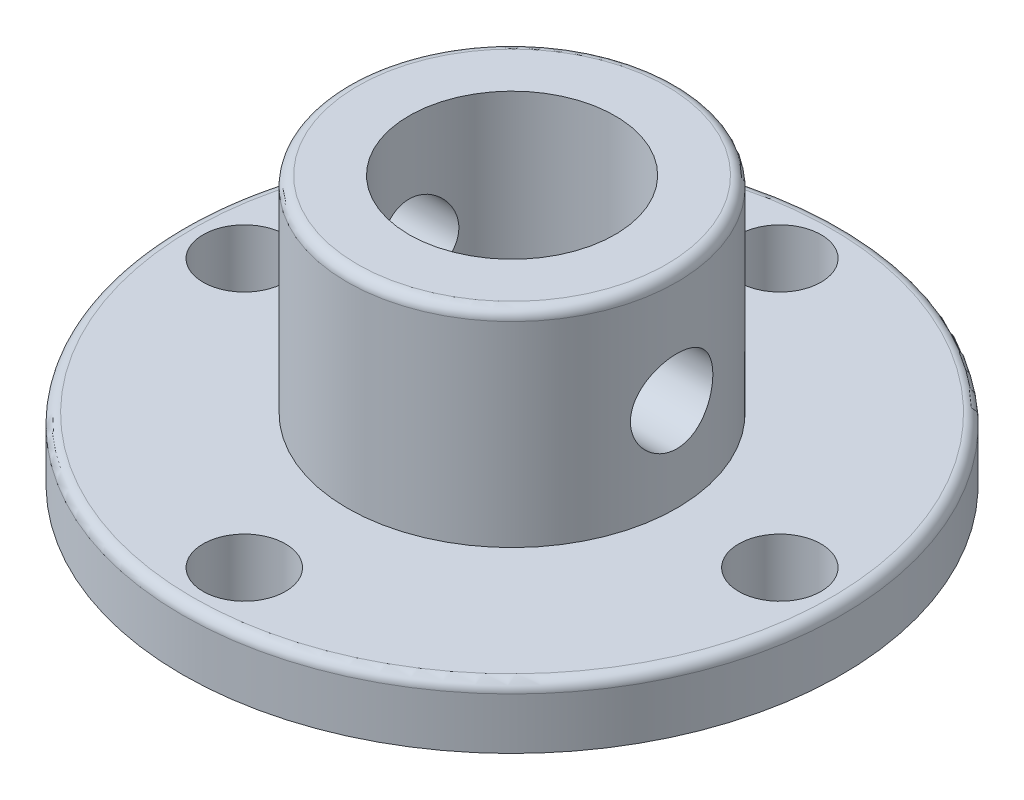
from build123d import *

# Parameters (mm, degrees)
SKETCH_1_R               = 16
EXTRUDE_1_DEPTH          = 3
SKETCH_2_R               = 8
EXTRUDE_2_DEPTH          = 10
SKETCH_3_R               = 5
CUT_EXTRUDE_1_DEPTH      = 27.095976701
SKETCH_4_R               = 2
CUT_EXTRUDE_2_DEPTH      = 7
CUT_EXTRUDE_3_DEPTH      = 27.095976701
CUT_EXTRUDE_3_DEPTH_BACK = 27.095976701
SKETCH_5_R               = 2
FILLET_1_R               = 0.5
FILLET_2_R               = 0.5


with BuildPart() as part:
    # 草图1 → 凸台-拉伸1 (new body)
    with BuildSketch(Plane(origin=(0, 0, 0), x_dir=(1, 0, 0), z_dir=(0, 1, 0))):
        with Locations(Location((0, 0, 0), (0, 0, 270))):
            Circle(SKETCH_1_R)
    extrude(amount=EXTRUDE_1_DEPTH)

    # 草图2 → 凸台-拉伸2 (add)
    with BuildSketch(Plane(origin=(0, 3, 0), x_dir=(1, 0, 0), z_dir=(0, 1, 0))):
        with Locations(Location((0, 0, 0), (0, 0, 270))):
            Circle(SKETCH_2_R)
    extrude(amount=EXTRUDE_2_DEPTH)

    # 草图3 → 切除-拉伸1 (cut, through all)
    with BuildSketch(Plane(origin=(0, 13, 0), x_dir=(1, 0, 0), z_dir=(0, 1, 0))):
        with Locations(Location((0, 0, 0), (0, 0, 270))):
            Circle(SKETCH_3_R)
    extrude(amount=-CUT_EXTRUDE_1_DEPTH, mode=Mode.SUBTRACT)

    # 草图4 → 切除-拉伸2 (cut)
    with BuildSketch(Plane(origin=(0, 3, 0), x_dir=(1, 0, 0), z_dir=(0, 1, 0))):
        with Locations(Location((0, 13, 0), (0, 0, 270))):
            Circle(SKETCH_4_R)
        with Locations(Location((-13, 0, 0), (0, 0, 270))):
            Circle(SKETCH_4_R)
        with Locations(Location((0, -13, 0), (0, 0, 270))):
            Circle(SKETCH_4_R)
        with Locations(Location((13, 0, 0), (0, 0, 270))):
            Circle(SKETCH_4_R)
    extrude(amount=-CUT_EXTRUDE_2_DEPTH, mode=Mode.SUBTRACT)

    # 草图5 → 切除-拉伸3 (cut, two sides: drawn at the far end of the back side and taken through both)
    with BuildSketch(Plane(origin=(0, 0, 0), x_dir=(0, 0, -1), z_dir=(1, 0, 0)).offset(-CUT_EXTRUDE_3_DEPTH_BACK)):
        with Locations((0, 7.5)):
            Circle(SKETCH_5_R)
    extrude(amount=CUT_EXTRUDE_3_DEPTH + CUT_EXTRUDE_3_DEPTH_BACK, mode=Mode.SUBTRACT)

    # 圆角1
    fillet_1_edges = [part.edges().sort_by_distance(p)[0] for p in [
        (0, 3, -16),
    ]]
    fillet(fillet_1_edges, radius=FILLET_1_R)

    # 圆角2
    fillet_2_edges = [part.edges().sort_by_distance(p)[0] for p in [
        (0, 13, -8),
    ]]
    fillet(fillet_2_edges, radius=FILLET_2_R)


solid = part.part
